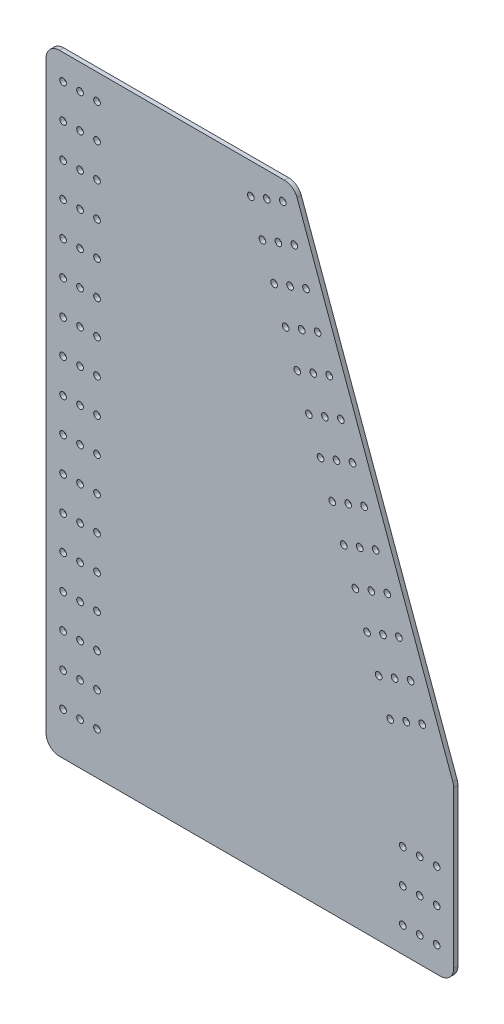
from build123d import *

# Parameters (mm, degrees)
BOSS_EXTRUDE1_DEPTH = 3.175
FILLET1_R           = 10
SKETCH2_R           = 2.4892
CUT_EXTRUDE1_DEPTH  = 550.495187081


with BuildPart() as part:
    # Sketch1 → Boss-Extrude1 (new body)
    with BuildSketch(Plane.XY):
        Polygon((268.470039594, 228.6), (185.266444041, 457.2), (0, 457.2), (0, 0), (304.8, 0), (304.8, 128.784254135), align=None)
    extrude(amount=BOSS_EXTRUDE1_DEPTH)

    # Fillet1
    fillet1_edges = [part.edges().sort_by_distance(p)[0] for p in [
        (304.8, 128.784254135, 1.5875),
        (304.8, 0, 1.5875),
        (0, 0, 1.5875),
        (0, 457.2, 1.5875),
        (185.266444041, 457.2, 1.5875),
    ]]
    fillet(fillet1_edges, radius=FILLET1_R)

    # Sketch2 → Cut-Extrude1 (cut, through all)
    with BuildSketch(Plane.XY.offset(3.175)):
        with Locations((12.7, 438.15)):
            Circle(SKETCH2_R)
        with Locations((25.4, 438.15)):
            Circle(SKETCH2_R)
        with Locations((38.1, 438.15)):
            Circle(SKETCH2_R)
        with Locations((266.7, 19.05)):
            Circle(SKETCH2_R)
        with Locations((279.4, 19.05)):
            Circle(SKETCH2_R)
        with Locations((292.1, 19.05)):
            Circle(SKETCH2_R)
        with Locations((12.7, 412.75)):
            Circle(SKETCH2_R)
        with Locations((25.4, 412.75)):
            Circle(SKETCH2_R)
        with Locations((38.1, 412.75)):
            Circle(SKETCH2_R)
        with Locations((12.7, 387.35)):
            Circle(SKETCH2_R)
        with Locations((25.4, 387.35)):
            Circle(SKETCH2_R)
        with Locations((38.1, 387.35)):
            Circle(SKETCH2_R)
        with Locations((12.7, 361.95)):
            Circle(SKETCH2_R)
        with Locations((25.4, 361.95)):
            Circle(SKETCH2_R)
        with Locations((38.1, 361.95)):
            Circle(SKETCH2_R)
        with Locations((12.7, 336.55)):
            Circle(SKETCH2_R)
        with Locations((25.4, 336.55)):
            Circle(SKETCH2_R)
        with Locations((38.1, 336.55)):
            Circle(SKETCH2_R)
        with Locations((12.7, 311.15)):
            Circle(SKETCH2_R)
        with Locations((25.4, 311.15)):
            Circle(SKETCH2_R)
        with Locations((38.1, 311.15)):
            Circle(SKETCH2_R)
        with Locations((12.7, 285.75)):
            Circle(SKETCH2_R)
        with Locations((25.4, 285.75)):
            Circle(SKETCH2_R)
        with Locations((38.1, 285.75)):
            Circle(SKETCH2_R)
        with Locations((12.7, 260.35)):
            Circle(SKETCH2_R)
        with Locations((25.4, 260.35)):
            Circle(SKETCH2_R)
        with Locations((38.1, 260.35)):
            Circle(SKETCH2_R)
        with Locations((12.7, 234.95)):
            Circle(SKETCH2_R)
        with Locations((25.4, 234.95)):
            Circle(SKETCH2_R)
        with Locations((38.1, 234.95)):
            Circle(SKETCH2_R)
        with Locations((12.7, 209.55)):
            Circle(SKETCH2_R)
        with Locations((25.4, 209.55)):
            Circle(SKETCH2_R)
        with Locations((38.1, 209.55)):
            Circle(SKETCH2_R)
        with Locations((12.7, 184.15)):
            Circle(SKETCH2_R)
        with Locations((25.4, 184.15)):
            Circle(SKETCH2_R)
        with Locations((38.1, 184.15)):
            Circle(SKETCH2_R)
        with Locations((12.7, 158.75)):
            Circle(SKETCH2_R)
        with Locations((25.4, 158.75)):
            Circle(SKETCH2_R)
        with Locations((38.1, 158.75)):
            Circle(SKETCH2_R)
        with Locations((12.7, 133.35)):
            Circle(SKETCH2_R)
        with Locations((25.4, 133.35)):
            Circle(SKETCH2_R)
        with Locations((38.1, 133.35)):
            Circle(SKETCH2_R)
        with Locations((12.7, 107.95)):
            Circle(SKETCH2_R)
        with Locations((25.4, 107.95)):
            Circle(SKETCH2_R)
        with Locations((38.1, 107.95)):
            Circle(SKETCH2_R)
        with Locations((12.7, 82.55)):
            Circle(SKETCH2_R)
        with Locations((25.4, 82.55)):
            Circle(SKETCH2_R)
        with Locations((38.1, 82.55)):
            Circle(SKETCH2_R)
        with Locations((12.7, 57.15)):
            Circle(SKETCH2_R)
        with Locations((25.4, 57.15)):
            Circle(SKETCH2_R)
        with Locations((38.1, 57.15)):
            Circle(SKETCH2_R)
        with Locations((12.7, 31.75)):
            Circle(SKETCH2_R)
        with Locations((25.4, 31.75)):
            Circle(SKETCH2_R)
        with Locations((38.1, 31.75)):
            Circle(SKETCH2_R)
        with Locations((176.985779996, 442.8186216)):
            Circle(SKETCH2_R)
        with Locations((165.051683712, 438.47496578)):
            Circle(SKETCH2_R)
        with Locations((153.117587428, 434.13130996)):
            Circle(SKETCH2_R)
        with Locations((266.7, 44.45)):
            Circle(SKETCH2_R)
        with Locations((279.4, 44.45)):
            Circle(SKETCH2_R)
        with Locations((292.1, 44.45)):
            Circle(SKETCH2_R)
        with Locations((266.7, 69.85)):
            Circle(SKETCH2_R)
        with Locations((279.4, 69.85)):
            Circle(SKETCH2_R)
        with Locations((292.1, 69.85)):
            Circle(SKETCH2_R)
        with Locations((161.804899069, 410.263117392)):
            Circle(SKETCH2_R)
        with Locations((173.738995353, 414.606773212)):
            Circle(SKETCH2_R)
        with Locations((185.673091636, 418.950429032)):
            Circle(SKETCH2_R)
        with Locations((170.492210709, 386.394924824)):
            Circle(SKETCH2_R)
        with Locations((182.426306993, 390.738580644)):
            Circle(SKETCH2_R)
        with Locations((194.360403277, 395.082236464)):
            Circle(SKETCH2_R)
        with Locations((179.179522349, 362.526732256)):
            Circle(SKETCH2_R)
        with Locations((191.113618633, 366.870388076)):
            Circle(SKETCH2_R)
        with Locations((203.047714917, 371.214043896)):
            Circle(SKETCH2_R)
        with Locations((187.86683399, 338.658539688)):
            Circle(SKETCH2_R)
        with Locations((199.800930274, 343.002195508)):
            Circle(SKETCH2_R)
        with Locations((211.735026558, 347.345851328)):
            Circle(SKETCH2_R)
        with Locations((196.55414563, 314.79034712)):
            Circle(SKETCH2_R)
        with Locations((208.488241914, 319.13400294)):
            Circle(SKETCH2_R)
        with Locations((220.422338198, 323.47765876)):
            Circle(SKETCH2_R)
        with Locations((205.241457271, 290.922154552)):
            Circle(SKETCH2_R)
        with Locations((217.175553555, 295.265810372)):
            Circle(SKETCH2_R)
        with Locations((229.109649839, 299.609466192)):
            Circle(SKETCH2_R)
        with Locations((213.928768911, 267.053961984)):
            Circle(SKETCH2_R)
        with Locations((225.862865195, 271.397617804)):
            Circle(SKETCH2_R)
        with Locations((237.796961479, 275.741273624)):
            Circle(SKETCH2_R)
        with Locations((222.616080552, 243.185769416)):
            Circle(SKETCH2_R)
        with Locations((234.550176836, 247.529425236)):
            Circle(SKETCH2_R)
        with Locations((246.48427312, 251.873081056)):
            Circle(SKETCH2_R)
        with Locations((231.303392192, 219.317576848)):
            Circle(SKETCH2_R)
        with Locations((243.237488476, 223.661232668)):
            Circle(SKETCH2_R)
        with Locations((255.17158476, 228.004888488)):
            Circle(SKETCH2_R)
        with Locations((239.990703833, 195.44938428)):
            Circle(SKETCH2_R)
        with Locations((251.924800117, 199.7930401)):
            Circle(SKETCH2_R)
        with Locations((263.858896401, 204.13669592)):
            Circle(SKETCH2_R)
        with Locations((248.678015473, 171.581191712)):
            Circle(SKETCH2_R)
        with Locations((260.612111757, 175.924847532)):
            Circle(SKETCH2_R)
        with Locations((272.546208041, 180.268503352)):
            Circle(SKETCH2_R)
        with Locations((257.365327114, 147.712999144)):
            Circle(SKETCH2_R)
        with Locations((269.299423398, 152.056654964)):
            Circle(SKETCH2_R)
        with Locations((281.233519682, 156.400310784)):
            Circle(SKETCH2_R)
    extrude(amount=-CUT_EXTRUDE1_DEPTH, mode=Mode.SUBTRACT)


solid = part.part
